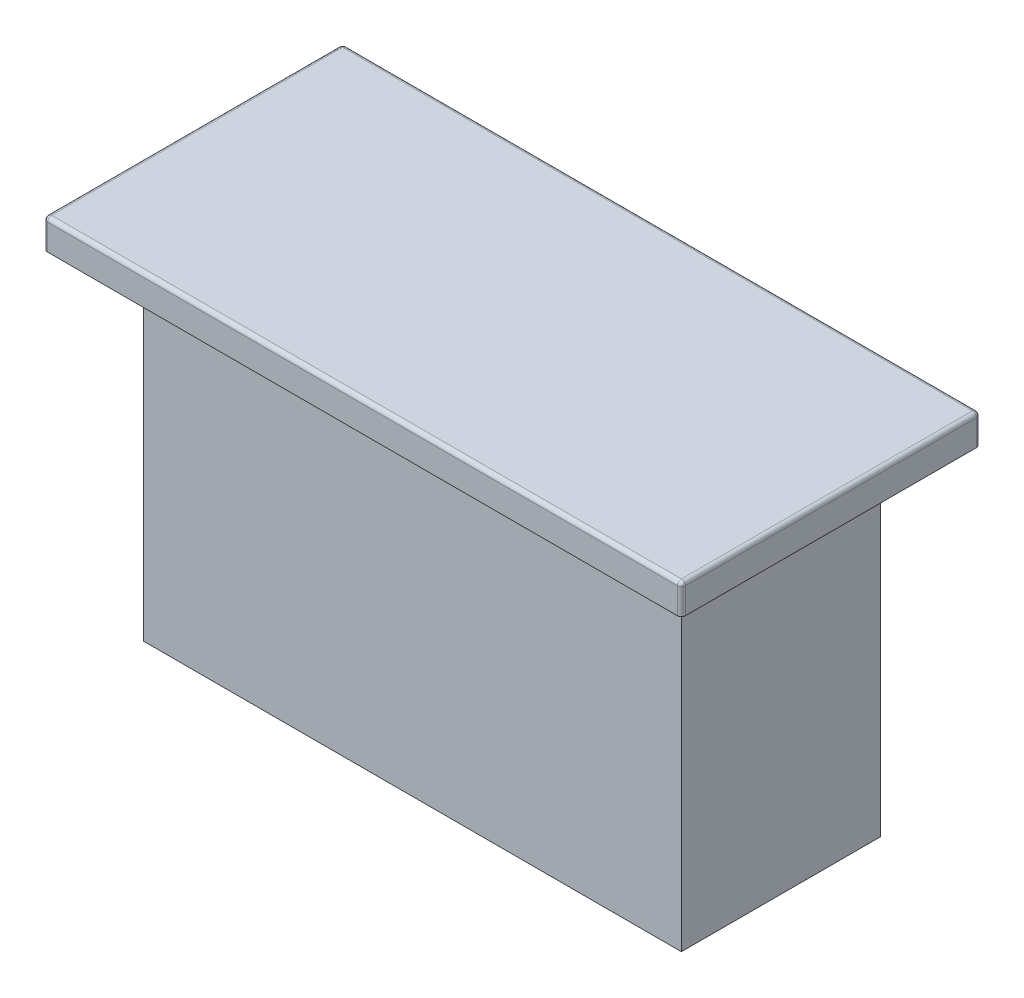
from build123d import *

# Parameters (mm, degrees)
SKETCH1_W           = 32
SKETCH1_H           = 15
BOSS_EXTRUDE1_DEPTH = 1.5
FILLET2_R           = 0.2
SKETCH2_W           = 27
SKETCH2_H           = 10
BOSS_EXTRUDE2_DEPTH = 18.5


with BuildPart() as part:
    # Sketch1 → Boss-Extrude1 (new body)
    with BuildSketch(Plane(origin=(0, 0, 0), x_dir=(1, 0, 0), z_dir=(0, 1, 0))):
        with Locations((-16, 7.5)):
            Rectangle(SKETCH1_W, SKETCH1_H)
    extrude(amount=BOSS_EXTRUDE1_DEPTH)

    # Fillet2
    fillet2_edges = [part.edges().sort_by_distance(p)[0] for p in [
        (-32, 1.5, -7.5),
        (-16, 1.5, 0),
        (0, 1.5, -7.5),
        (-16, 1.5, -15),
        (0, 0.75, 0),
        (-32, 0.75, 0),
        (-32, 0.75, -15),
        (0, 0.75, -15),
    ]]
    fillet(fillet2_edges, radius=FILLET2_R)

    # Sketch2 → Boss-Extrude2 (add)
    with BuildSketch(Plane(origin=(0, 1.5, 0), x_dir=(1, 0, 0), z_dir=(0, 1, 0))):
        with Locations((-16, 7.5)):
            Rectangle(SKETCH2_W, SKETCH2_H)
    extrude(amount=-BOSS_EXTRUDE2_DEPTH)


solid = part.part
